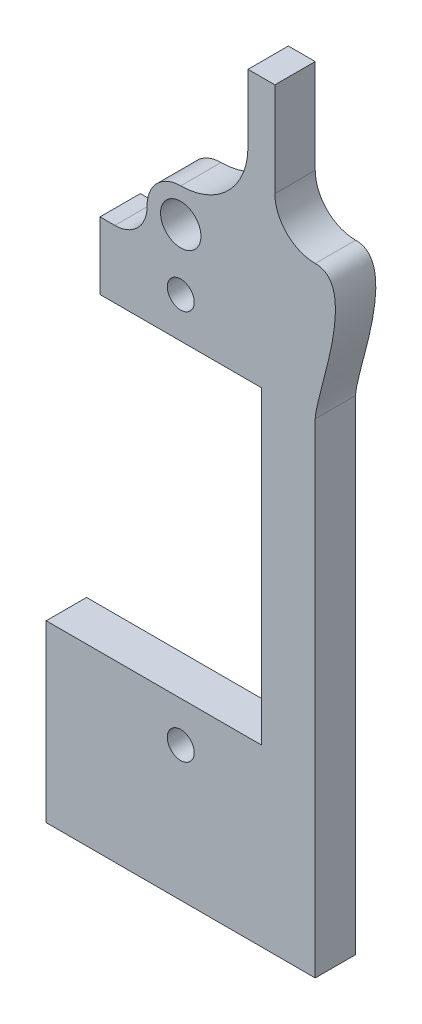
from build123d import *

# Parameters (mm, degrees)
CROQUIS2_R              = 1.5
CROQUIS2_R_2            = 1
SALIENTE_EXTRUIR1_DEPTH = 3


with BuildPart() as part:
    # Croquis2 → Saliente-Extruir1 (new body)
    with BuildSketch(Plane.XY):
        with BuildLine():
            Line((10, 0), (10, 30))
            add(Edge.make_bspline(
                [(10, 40), (13.382456464, 40), (10, 31.604422757), (10, 30)],
                knots=[0, 0, 0, 0, 1, 1, 1, 1], degree=3))
            ThreePointArc((10, 40), (7.878679656, 40.878679656), (7, 43))
            Line((7, 43), (7, 50))
            Line((7, 50), (5, 50))
            Line((5, 50), (5, 45))
            ThreePointArc((5, 45), (3.535533906, 41.464466094), (0, 40))
            ThreePointArc((0, 40), (-1.767766953, 39.267766953), (-2.5, 37.5))
            Line((-2.5, 37.5), (-2.5, 37.4))
            ThreePointArc((-2.5, 37.4), (-3.202943725, 35.702943725), (-4.9, 35))
            Line((-4.9, 35), (-6, 35))
            Line((-6, 35), (-6, 30))
            Line((-6, 30), (6, 30))
            Line((6, 30), (6, 7))
            Line((6, 7), (-10, 7))
            Line((-10, 7), (-10, 0))
            Line((-10, 0), (-10, -6))
            Line((-10, -6), (10, -6))
            Line((10, -6), (10, 0))
        make_face()
        with Locations((0, 37.5)):
            Circle(CROQUIS2_R, mode=Mode.SUBTRACT)
        with Locations((0, 33)):
            Circle(CROQUIS2_R_2, mode=Mode.SUBTRACT)
        with Locations((0, 4)):
            Circle(CROQUIS2_R_2, mode=Mode.SUBTRACT)
    extrude(amount=SALIENTE_EXTRUIR1_DEPTH)


solid = part.part
